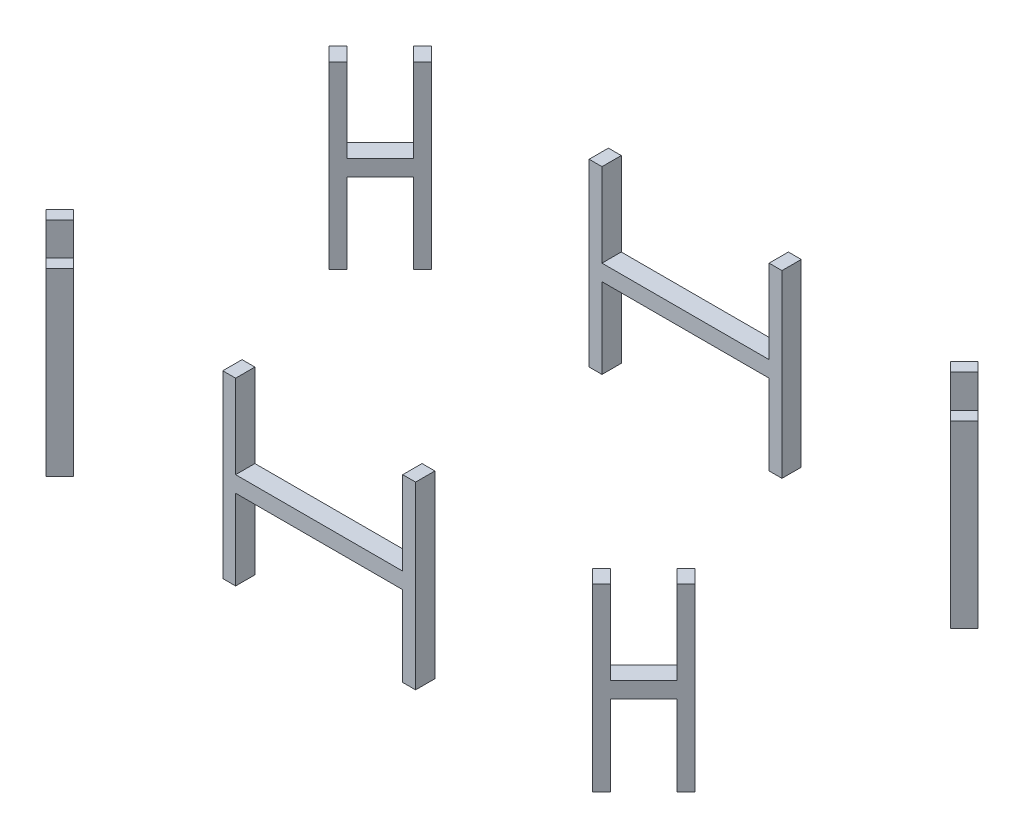
from build123d import *

# Parameters (mm, degrees)
EXTRUDE_1_DEPTH          = 280
EXTRUDE_1_2_DEPTH        = 280
EXTRUDE_1_3_DEPTH        = 280
EXTRUDE_1_4_DEPTH        = 280
EXTRUDE_1_5_DEPTH        = 280
EXTRUDE_1_6_DEPTH        = 280
CUT_EXTRUDE_1_DEPTH      = 833.72144202
CUT_EXTRUDE_1_DEPTH_BACK = 833.72144202
SKETCH_2_W               = 260
SKETCH_2_H               = 130
SKETCH_2_H_2             = 125
SKETCH_3_W               = 73.13708499
SKETCH_3_H               = 130
SKETCH_3_H_2             = 125
CUT_EXTRUDE_2_DEPTH      = 30
SKETCH_4_W               = 73.13708499
SKETCH_4_H               = 130
CUT_EXTRUDE_3_DEPTH      = 30
SKETCH_5_W               = 73.13708499
SKETCH_5_H               = 130
SKETCH_5_H_2             = 125
CUT_EXTRUDE_4_DEPTH      = 30
SKETCH_6_W               = 73.13708499
SKETCH_6_H               = 130
CUT_EXTRUDE_5_DEPTH      = 30


with BuildPart() as part:
    # 草图1 → 凸台-拉伸1 (new body)
    with BuildSketch(Plane(origin=(0, 0, 0), x_dir=(1, 0, 0), z_dir=(0, 1, 0))):
        Polygon((-505, 220), (-425, 300), (-403.786796564, 278.786796564), (-483.786796564, 198.786796564), align=None)
    extrude(amount=EXTRUDE_1_DEPTH)

    # 草图5 → 切除-拉伸4 (cut)
    with BuildSketch(Plane(origin=(-362.5, 0, -362.5), x_dir=(-0.7071067811865475, 0, 0.7071067811865477), z_dir=(-0.7071067811865477, 0, -0.7071067811865475))):
        with Locations((144.956890143, 215)):
            Rectangle(SKETCH_5_W, SKETCH_5_H)
        with Locations((144.956890143, 62.5)):
            Rectangle(SKETCH_5_W, SKETCH_5_H_2)
    extrude(amount=-CUT_EXTRUDE_4_DEPTH, mode=Mode.SUBTRACT)


with BuildPart() as body_2:
    # 草图1 → Extrude 1 2 (new body)
    with BuildSketch(Plane(origin=(0, 0, 0), x_dir=(1, 0, 0), z_dir=(0, 1, 0))):
        Polygon((-150, 270), (150, 270), (150, 300), (0, 300), (-150, 300), align=None)
    extrude(amount=EXTRUDE_1_2_DEPTH)


with BuildPart() as body_3:
    # 草图1 → Extrude 1 3 (new body)
    with BuildSketch(Plane(origin=(0, 0, 0), x_dir=(1, 0, 0), z_dir=(0, 1, 0))):
        Polygon((505, 220), (483.786796564, 198.786796564), (403.786796564, 278.786796564), (425, 300), align=None)
    extrude(amount=EXTRUDE_1_3_DEPTH)

    # 草图4 → 切除-拉伸3 (cut)
    with BuildSketch(Plane(origin=(362.5, 0, -362.5), x_dir=(-0.7071067811865475, 0, -0.7071067811865477), z_dir=(0.7071067811865477, 0, -0.7071067811865475))):
        with Locations((-144.956890143, 215)):
            Rectangle(SKETCH_4_W, SKETCH_4_H)
        with Locations((-144.956890143, 65)):
            Rectangle(SKETCH_4_W, SKETCH_4_H)
    extrude(amount=-CUT_EXTRUDE_3_DEPTH, mode=Mode.SUBTRACT)


with BuildPart() as body_4:
    # 草图1 → Extrude 1 4 (new body)
    with BuildSketch(Plane(origin=(0, 0, 0), x_dir=(1, 0, 0), z_dir=(0, 1, 0))):
        Polygon((505, -220), (425, -300), (403.786796564, -278.786796564), (483.786796564, -198.786796564), align=None)
    extrude(amount=EXTRUDE_1_4_DEPTH)

    # 草图3 → 切除-拉伸2 (cut)
    with BuildSketch(Plane(origin=(362.5, 0, 362.5), x_dir=(0.7071067811865475, 0, -0.7071067811865477), z_dir=(0.7071067811865477, 0, 0.7071067811865475))):
        with Locations((144.956890143, 215)):
            Rectangle(SKETCH_3_W, SKETCH_3_H)
        with Locations((144.956890143, 62.5)):
            Rectangle(SKETCH_3_W, SKETCH_3_H_2)
    extrude(amount=-CUT_EXTRUDE_2_DEPTH, mode=Mode.SUBTRACT)


with BuildPart() as body_5:
    # 草图1 → Extrude 1 5 (new body)
    with BuildSketch(Plane(origin=(0, 0, 0), x_dir=(1, 0, 0), z_dir=(0, 1, 0))):
        Polygon((-150, -300), (-150, -270), (150, -270), (150, -300), (0, -300), align=None)
    extrude(amount=EXTRUDE_1_5_DEPTH)


with BuildPart() as body_6:
    # 草图1 → Extrude 1 6 (new body)
    with BuildSketch(Plane(origin=(0, 0, 0), x_dir=(1, 0, 0), z_dir=(0, 1, 0))):
        Polygon((-505, -220), (-483.786796564, -198.786796564), (-403.786796564, -278.786796564), (-425, -300), align=None)
    extrude(amount=EXTRUDE_1_6_DEPTH)

    # 草图6 → 切除-拉伸5 (cut)
    with BuildSketch(Plane(origin=(-362.5, 0, 362.5), x_dir=(0.7071067811865475, 0, 0.7071067811865477), z_dir=(-0.7071067811865477, 0, 0.7071067811865475))):
        with Locations((-144.956890143, 215)):
            Rectangle(SKETCH_6_W, SKETCH_6_H)
        with Locations((-144.956890143, 65)):
            Rectangle(SKETCH_6_W, SKETCH_6_H)
    extrude(amount=-CUT_EXTRUDE_5_DEPTH, mode=Mode.SUBTRACT)


with BuildPart() as cut_extrude_1_tool:
    # 草图2 → 切除-拉伸1 (new, two sides: drawn at the far end of the back side and taken through both)
    with BuildSketch(Plane.XY.offset(300).offset(-CUT_EXTRUDE_1_DEPTH_BACK)):
        with Locations((0, 215)):
            Rectangle(SKETCH_2_W, SKETCH_2_H)
        with Locations((0, 62.5)):
            Rectangle(SKETCH_2_W, SKETCH_2_H_2)
    extrude(amount=CUT_EXTRUDE_1_DEPTH + CUT_EXTRUDE_1_DEPTH_BACK)


with BuildPart() as body_2_1:
    add(body_2.part)

    # 切除-拉伸1: cut by cut_extrude_1_tool
    add(cut_extrude_1_tool.part, mode=Mode.SUBTRACT)


with BuildPart() as body_5_1:
    add(body_5.part)

    # 切除-拉伸1: cut by cut_extrude_1_tool
    add(cut_extrude_1_tool.part, mode=Mode.SUBTRACT)


solid = Compound([part.part, body_3.part, body_4.part, body_6.part, body_2_1.part, body_5_1.part])
